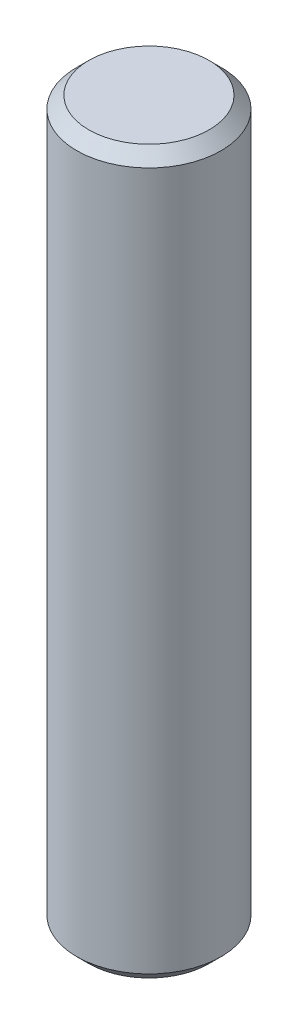
from build123d import *

# Parameters (mm, degrees)
SKETCH1_R           = 3
BOSS_EXTRUDE1_DEPTH = 30
CHAMFER1_SIZE       = 0.5


with BuildPart() as part:
    # Sketch1 → Boss-Extrude1 (new body)
    with BuildSketch(Plane(origin=(0, 0, 0), x_dir=(1, 0, 0), z_dir=(0, 1, 0))):
        with Locations(Location((0, 0, 0), (0, 0, 270))):
            Circle(SKETCH1_R)
    extrude(amount=BOSS_EXTRUDE1_DEPTH)

    # Chamfer1
    chamfer1_edges = [part.edges().sort_by_distance(p)[0] for p in [
        (0, 0, -3),
        (0, 30, -3),
    ]]
    chamfer(chamfer1_edges, length=CHAMFER1_SIZE)


solid = part.part
